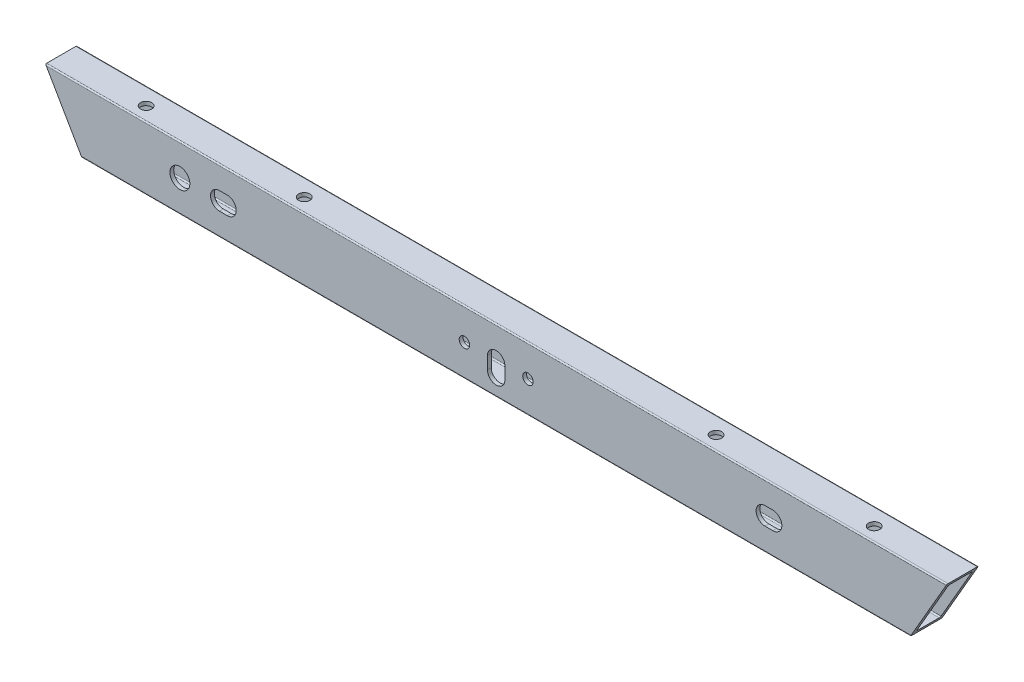
from build123d import *

# Parameters (mm, degrees)
BOSS_EXTRUDE1_DEPTH       = 12.7
CUT_EXTRUDE1_DEPTH        = 364.062325917
CUT_EXTRUDE1_DEPTH_BACK   = 364.062325917
SKETCH3_W                 = 19.304
SKETCH3_H                 = 44.704
FILLET1_R                 = 1
WIREHOLE_REACH            = 365.728
MIDDLEHOLE_REACH          = 365.728
SKETCH5_R                 = 15
SPACERHOLESM8_D           = 8.4
WIRE_SLOTS_REACH          = 365.728
PLATE_MOUNTING_REACH      = 367.718
SKETCH14_R                = 4.5
M6X1_0_TAPPED_HOLE1_D     = 5
M6X1_0_TAPPED_HOLE1_DEPTH = 5.588
CUT_EXTRUDE5_DEPTH        = 365.834993524
CUT_EXTRUDE5_DEPTH_BACK   = 365.834993524
SKETCH10_W                = 25.4
SKETCH10_H                = 50.8
POWER_D                   = 16


with BuildPart() as part:
    # Sketch2 → Boss-Extrude1 (new, symmetric)
    with BuildSketch(Plane.XY):
        Polygon((-332.620606325, -25.4), (-361.95, 25.4), (361.95, 25.4), (332.620606325, -25.4), align=None)
    extrude(amount=BOSS_EXTRUDE1_DEPTH, both=True)

    # Sketch3 → Cut-Extrude1 (cut, two sides: drawn at the far end of the back side and taken through both)
    with BuildSketch(Plane(origin=(0, 0, 0), x_dir=(0, 0, -1), z_dir=(1, 0, 0)).offset(-CUT_EXTRUDE1_DEPTH_BACK)):
        Rectangle(SKETCH3_W, SKETCH3_H)
    extrude(amount=CUT_EXTRUDE1_DEPTH + CUT_EXTRUDE1_DEPTH_BACK, mode=Mode.SUBTRACT)

    # Fillet1
    fillet1_edges = [part.edges().sort_by_distance(p)[0] for p in [
        (0, -25.4, 12.7),
        (0, 22.352, -9.652),
        (0, -22.352, -9.652),
        (0, -22.352, 9.652),
        (0, 22.352, 9.652),
        (0, -25.4, -12.7),
        (0, 25.4, -12.7),
        (0, 25.4, 12.7),
    ]]
    fillet(fillet1_edges, radius=FILLET1_R)

    # Sketch4 → WireHole (cut, up to next)
    with BuildSketch(Plane(origin=(0, 0, -12.7), x_dir=(-1, 0, 0), z_dir=(0, 0, -1)), mode=Mode.PRIVATE) as wirehole_sk1:
        with BuildLine():
            Line((-7, 0), (-7, -10))
            ThreePointArc((-7, -10), (0, -17), (7, -10))
            Line((7, -10), (7, 0))
            ThreePointArc((7, 0), (0, 7), (-7, 0))
        make_face()
    wirehole_tool1 = extrude(wirehole_sk1.sketch, amount=-WIREHOLE_REACH, mode=Mode.PRIVATE) & part.part
    add(wirehole_tool1.solids().sort_by_distance((0, -5, -12.7))[0], mode=Mode.SUBTRACT)

    # Sketch5 → MiddleHole (cut, up to next)
    with BuildSketch(Plane.XY.offset(12.7), mode=Mode.PRIVATE) as middlehole_sk1:
        Circle(SKETCH5_R)
    middlehole_tool1 = extrude(middlehole_sk1.sketch, amount=-MIDDLEHOLE_REACH, mode=Mode.PRIVATE) & part.part
    add(middlehole_tool1.solids().sort_by_distance((0, 0, 12.7))[0], mode=Mode.SUBTRACT)

    # SpacerHolesM8 (through all)
    with Locations(Plane.XY.offset(12.7)):
        with Locations((-25.5, 0), (25.5, 0)):
            Hole(SPACERHOLESM8_D / 2)

    # Sketch9 → Wire Slots (cut, up to next)
    with BuildSketch(Plane(origin=(0, 0, -12.7), x_dir=(-1, 0, 0), z_dir=(0, 0, -1)), mode=Mode.PRIVATE) as wire_slots_sk1:
        with BuildLine():
            Line((-222.25, 7.14375), (-215.9, 7.14375))
            ThreePointArc((-215.9, 7.14375), (-208.75625, 0), (-215.9, -7.14375))
            Line((-215.9, -7.14375), (-222.25, -7.14375))
            ThreePointArc((-222.25, -7.14375), (-229.39375, 0), (-222.25, 7.14375))
        make_face()
    wire_slots_tool1 = extrude(wire_slots_sk1.sketch, amount=-WIRE_SLOTS_REACH, mode=Mode.PRIVATE) & part.part
    # Sketch9 → Wire Slots (cut, up to next)
    with BuildSketch(Plane(origin=(0, 0, -12.7), x_dir=(-1, 0, 0), z_dir=(0, 0, -1)), mode=Mode.PRIVATE) as wire_slots_sk2:
        with BuildLine():
            Line((222.25, 7.14375), (215.9, 7.14375))
            ThreePointArc((215.9, 7.14375), (208.75625, 0), (215.9, -7.14375))
            Line((215.9, -7.14375), (222.25, -7.14375))
            ThreePointArc((222.25, -7.14375), (229.39375, 0), (222.25, 7.14375))
        make_face()
    wire_slots_tool2 = extrude(wire_slots_sk2.sketch, amount=-WIRE_SLOTS_REACH, mode=Mode.PRIVATE) & part.part
    add(wire_slots_tool1.solids().sort_by_distance((219.075, 0, -12.7))[0], mode=Mode.SUBTRACT)
    add(wire_slots_tool2.solids().sort_by_distance((-219.075, 0, -12.7))[0], mode=Mode.SUBTRACT)

    # Sketch14 → Plate Mounting (cut, up to next)
    with BuildSketch(Plane(origin=(0, 25.4, 0), x_dir=(1, 0, 0), z_dir=(0, 1, 0)), mode=Mode.PRIVATE) as plate_mounting_sk1:
        with Locations(Location((-165.35, 1.475, 0), (0, 0, 180))):
            Circle(SKETCH14_R)
    plate_mounting_tool1 = extrude(plate_mounting_sk1.sketch, amount=-PLATE_MOUNTING_REACH, mode=Mode.PRIVATE) & part.part
    # Sketch14 → Plate Mounting (cut, up to next)
    with BuildSketch(Plane(origin=(0, 25.4, 0), x_dir=(1, 0, 0), z_dir=(0, 1, 0)), mode=Mode.PRIVATE) as plate_mounting_sk2:
        with Locations(Location((-292.35, 1.475, 0), (0, 0, 180))):
            Circle(SKETCH14_R)
    plate_mounting_tool2 = extrude(plate_mounting_sk2.sketch, amount=-PLATE_MOUNTING_REACH, mode=Mode.PRIVATE) & part.part
    # Sketch14 → Plate Mounting (cut, up to next)
    with BuildSketch(Plane(origin=(0, 25.4, 0), x_dir=(1, 0, 0), z_dir=(0, 1, 0)), mode=Mode.PRIVATE) as plate_mounting_sk3:
        with Locations(Location((292.35, 1.475, 0), (0, 0, 180))):
            Circle(SKETCH14_R)
    plate_mounting_tool3 = extrude(plate_mounting_sk3.sketch, amount=-PLATE_MOUNTING_REACH, mode=Mode.PRIVATE) & part.part
    # Sketch14 → Plate Mounting (cut, up to next)
    with BuildSketch(Plane(origin=(0, 25.4, 0), x_dir=(1, 0, 0), z_dir=(0, 1, 0)), mode=Mode.PRIVATE) as plate_mounting_sk4:
        with Locations(Location((165.35, 1.475, 0), (0, 0, 180))):
            Circle(SKETCH14_R)
    plate_mounting_tool4 = extrude(plate_mounting_sk4.sketch, amount=-PLATE_MOUNTING_REACH, mode=Mode.PRIVATE) & part.part
    add(plate_mounting_tool1.solids().sort_by_distance((-165.35, 25.4, -1.475))[0], mode=Mode.SUBTRACT)
    add(plate_mounting_tool2.solids().sort_by_distance((-292.35, 25.4, -1.475))[0], mode=Mode.SUBTRACT)
    add(plate_mounting_tool3.solids().sort_by_distance((292.35, 25.4, -1.475))[0], mode=Mode.SUBTRACT)
    add(plate_mounting_tool4.solids().sort_by_distance((165.35, 25.4, -1.475))[0], mode=Mode.SUBTRACT)

    # M6x1.0 Tapped Hole1
    with Locations(Plane(origin=(0, 0, 15.24), x_dir=(-1, 0, 0), z_dir=(0, 0, 1))):
        with Locations((-330.2, 0), (330.2, 0)):
            Hole(M6X1_0_TAPPED_HOLE1_D / 2, depth=M6X1_0_TAPPED_HOLE1_DEPTH)


with BuildPart() as body_2:
    # Mirror1: mirrored copy
    add(part.part.mirror(Plane(origin=(0, 0, -12.7), x_dir=(1, 0, 0), z_dir=(0, 0, -1))))

    # Power (through all)
    with Locations(Plane(origin=(0, 0, -38.1), x_dir=(-1, 0, 0), z_dir=(0, 0, -1))):
        with Locations((254, 0)):
            Hole(POWER_D / 2)


with BuildPart() as part_1:
    add(part.part)

    # Sketch10 → Cut-Extrude5 (cut, two sides: drawn at the far end of the back side and taken through both)
    with BuildSketch(Plane(origin=(0, 0, 0), x_dir=(0, 0, -1), z_dir=(1, 0, 0)).offset(-CUT_EXTRUDE5_DEPTH_BACK)):
        Rectangle(SKETCH10_W, SKETCH10_H)
    extrude(amount=CUT_EXTRUDE5_DEPTH + CUT_EXTRUDE5_DEPTH_BACK, mode=Mode.SUBTRACT)


solid = body_2.part
